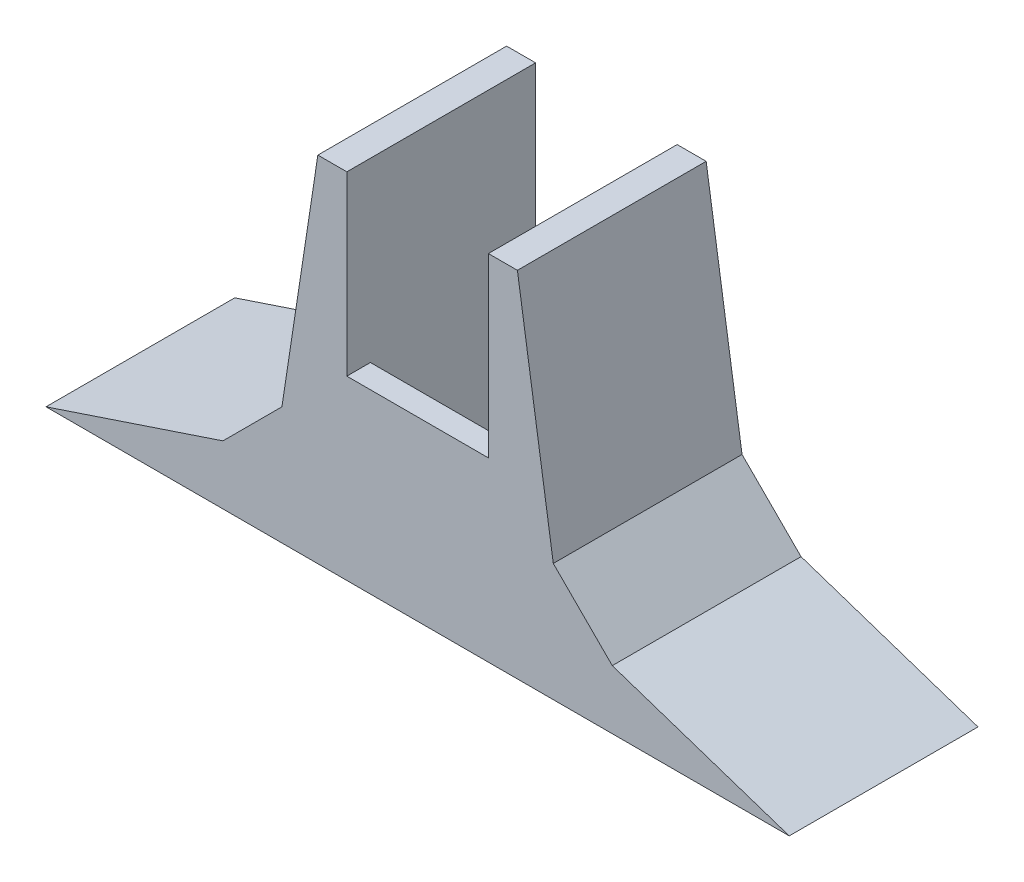
from build123d import *

# Parameters (mm, degrees)
EXTRUDE_2_DEPTH     = 16
SKETCH_3_W          = 12
SKETCH_3_H          = 12
CUT_EXTRUDE_3_DEPTH = 25
SKETCH_6_W          = 6
SKETCH_6_H          = 15
CUT_EXTRUDE_4_DEPTH = 25


with BuildPart() as part:
    # 스케치1 → 보스-돌출2 (new body)
    with BuildSketch(Plane.XY):
        Polygon((31.5, 0), (-31.5, 0), (-16.5, 5), (-11.5, 10), (-8.457539251, 30), (8.457539251, 30), (11.5, 10), (16.5, 5), align=None)
    extrude(amount=EXTRUDE_2_DEPTH)

    # 스케치3 → 컷-돌출3 (cut)
    with BuildSketch(Plane(origin=(0, 30, 0), x_dir=(1, 0, 0), z_dir=(0, 1, 0))):
        with Locations((0, -8)):
            Rectangle(SKETCH_3_W, SKETCH_3_H)
    extrude(amount=-CUT_EXTRUDE_3_DEPTH, mode=Mode.SUBTRACT)

    # 스케치6 → 컷-돌출4 (cut)
    with BuildSketch(Plane.XY.offset(16)):
        with Locations((3, 22.5)):
            Rectangle(SKETCH_6_W, SKETCH_6_H)
        with Locations((-3, 22.5)):
            Rectangle(SKETCH_6_W, SKETCH_6_H)
    extrude(amount=-CUT_EXTRUDE_4_DEPTH, mode=Mode.SUBTRACT)


solid = part.part
